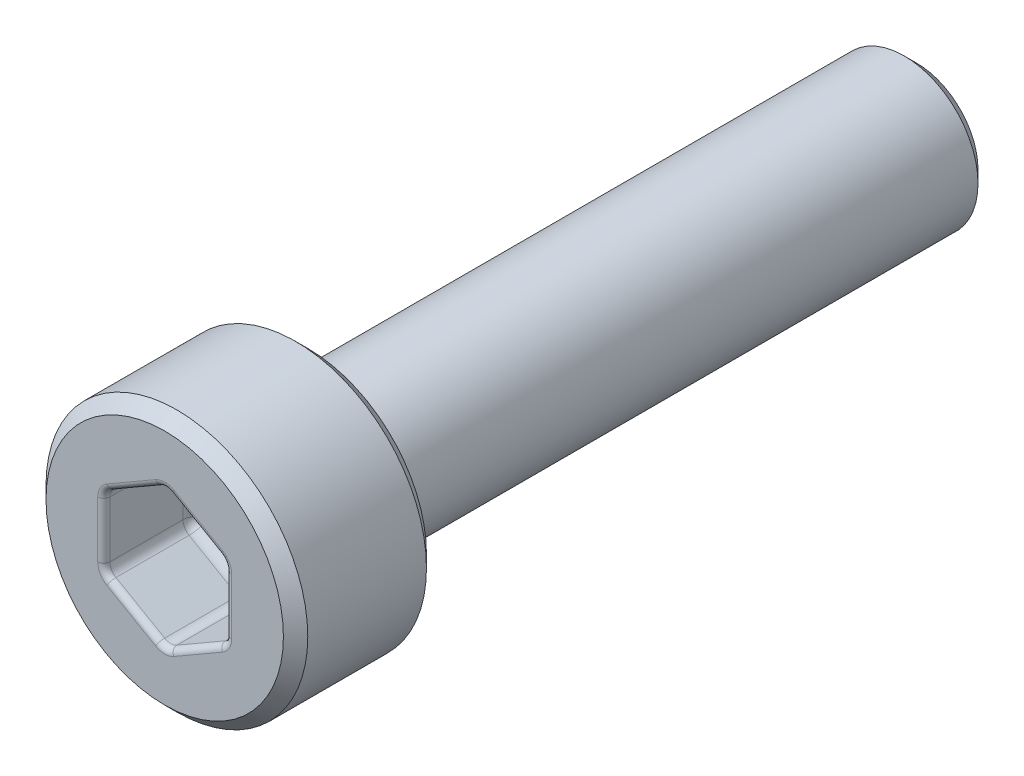
from build123d import *

# Parameters (mm, degrees)
SCHNITT_LINEAR_AUSTRAGEN1_DEPTH = 1.5
FASE1_SIZE                      = 0.2
VERRUNDUNG1_R                   = 0.2
VERRUNDUNG2_R                   = 0.1


with BuildPart() as part:
    # Skizze1 → Rotation1 (revolve)
    with BuildSketch(Plane(origin=(0, 0, 0), x_dir=(0, 0, -1), z_dir=(1, 0, 0))):
        Polygon((-2.35, 0), (-2.35, 2.15), (0, 2.15), (0, 1.21), (10, 1.21), (10, 0), align=None)
    revolve(axis=Axis((0, 0, 21.919879518), (0, 0, -1)))

    # Skizze2 → Schnitt-Linear austragen1 (cut)
    with BuildSketch(Plane.XY.offset(2.35)):
        Polygon((1, -0.577350269), (1, 0.577350269), (0, 1.154700538), (-1, 0.577350269), (-1, -0.577350269), (0, -1.154700538), align=None)
    extrude(amount=-SCHNITT_LINEAR_AUSTRAGEN1_DEPTH, mode=Mode.SUBTRACT)

    # Fase1
    fase1_edges = [part.edges().sort_by_distance(p)[0] for p in [
        (0, -2.15, 2.35),
        (0, -2.15, 0),
        (0, -1.21, -10),
    ]]
    chamfer(fase1_edges, length=FASE1_SIZE)

    # Verrundung1
    verrundung1_edges = [part.edges().sort_by_distance(p)[0] for p in [
        (-0.5, -0.866025404, 0.85),
        (-1, 0, 0.85),
        (-0.5, 0.866025404, 0.85),
        (0.5, 0.866025404, 0.85),
        (1, 0, 0.85),
        (0.5, -0.866025404, 0.85),
        (-1, -0.577350269, 1.6),
        (0, -1.154700538, 1.6),
        (1, -0.577350269, 1.6),
        (1, 0.577350269, 1.6),
        (0, 1.154700538, 1.6),
        (-1, 0.577350269, 1.6),
        (0, -1.21, 0),
    ]]
    fillet(verrundung1_edges, radius=VERRUNDUNG1_R)

    # Verrundung2
    verrundung2_edges = [part.edges().sort_by_distance(p)[0] for p in [
        (0.973205081, -0.561880215, 2.35),
        (0.5, -0.866025404, 2.35),
        (0, -1.123760431, 2.35),
        (-0.5, -0.866025404, 2.35),
        (-0.973205081, -0.561880215, 2.35),
        (-1, 0, 2.35),
        (-0.973205081, 0.561880215, 2.35),
        (-0.5, 0.866025404, 2.35),
        (0, 1.123760431, 2.35),
        (0.5, 0.866025404, 2.35),
        (0.973205081, 0.561880215, 2.35),
        (1, 0, 2.35),
    ]]
    fillet(verrundung2_edges, radius=VERRUNDUNG2_R)


solid = part.part
